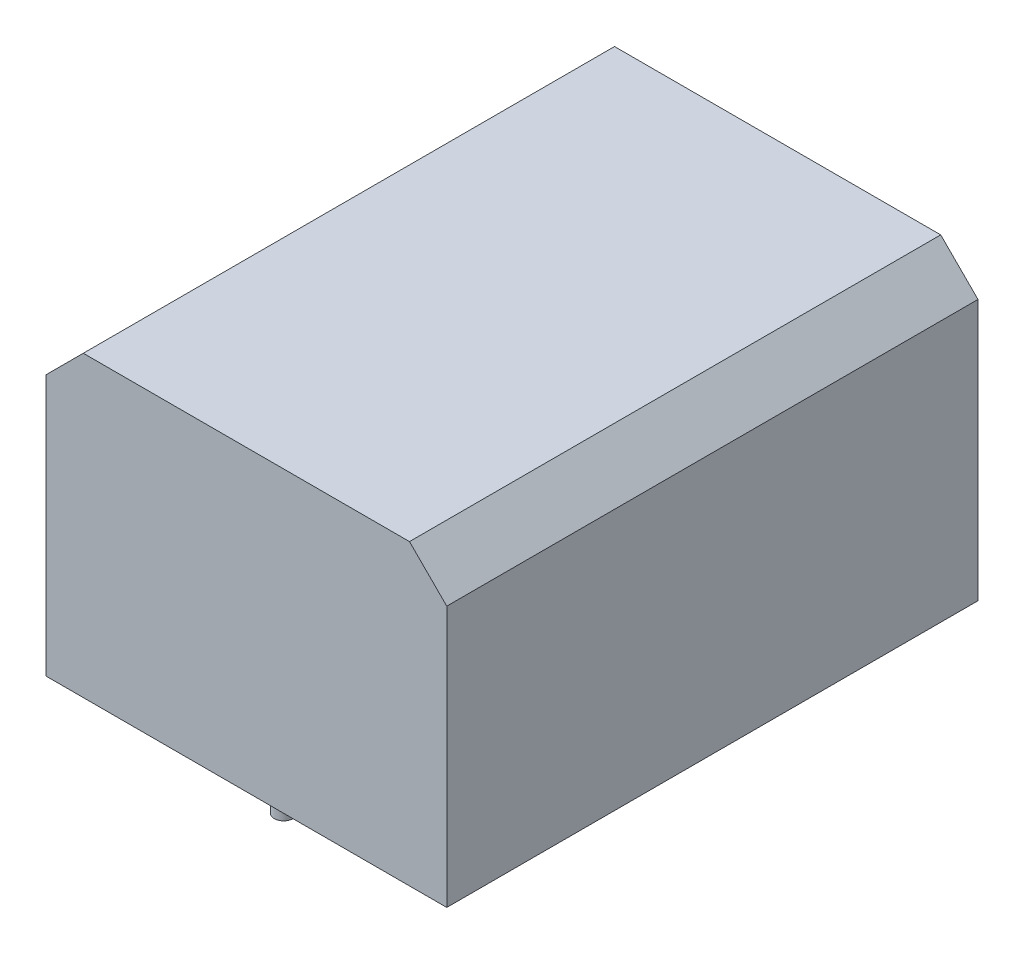
from build123d import *

# Parameters (mm, degrees)
EXTRUDE_2_DEPTH = 14.25
SKETCH_2_R      = 0.5
EXTRUDE_3_DEPTH = 2


with BuildPart() as part:
    # Эскиз1 → Бобышка-Вытянуть2 (new, symmetric)
    with BuildSketch(Plane.XY):
        Polygon((-10.75, 0), (10.75, 0), (10.75, 14), (8.75, 16), (-8.75, 16), (-10.75, 14), align=None)
    extrude(amount=EXTRUDE_2_DEPTH, both=True)

    # Эскиз2 → Бобышка-Вытянуть3 (add)
    with BuildSketch(Plane.XZ):
        with Locations(Location((0, 12.25, 0), (0, 0, 90))):
            Circle(SKETCH_2_R)
        with Locations(Location((0, -12.25, 0), (0, 0, 90))):
            Circle(SKETCH_2_R)
    extrude(amount=EXTRUDE_3_DEPTH)


solid = part.part
